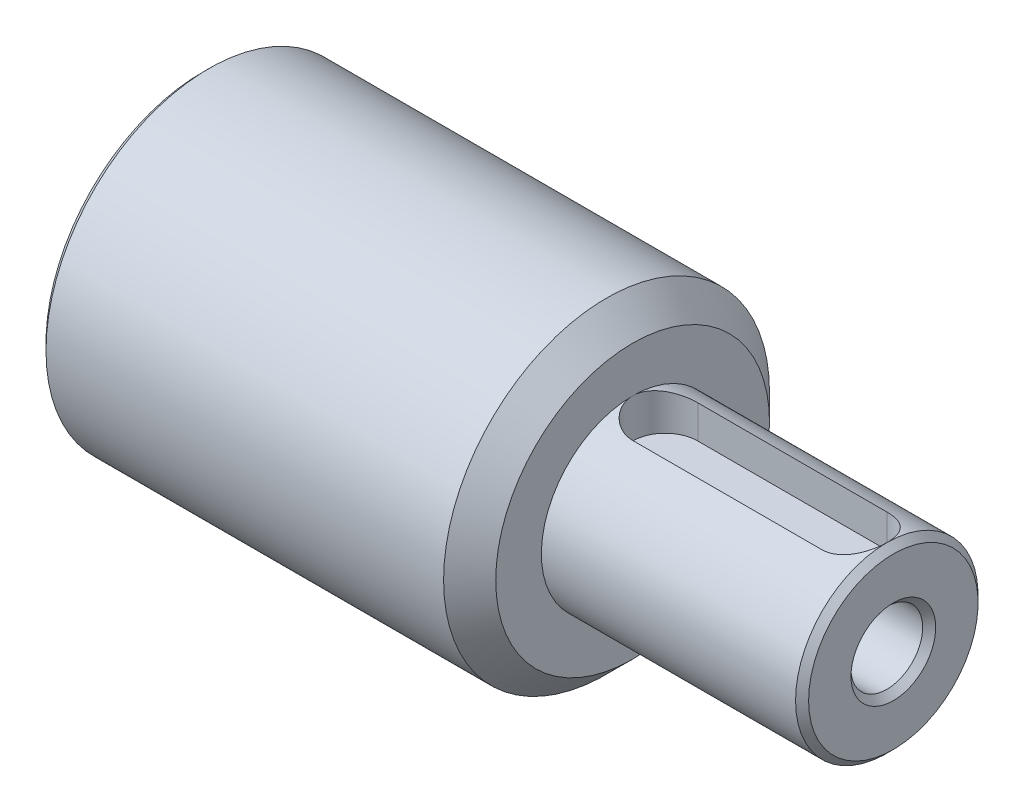
from build123d import *

# Parameters (mm, degrees)
SKETCH_2_W          = 5
SKETCH_2_H          = 9
CUT_EXTRUDE_1_DEPTH = 26
CHAMFER_1_SIZE      = 2
CHAMFER_2_SIZE      = 0.5
FILLET_1_R          = 1
CUT_EXTRUDE_2_DEPTH = 3


with BuildPart() as part:
    # 草图1 → 旋转1 (revolve)
    with BuildSketch(Plane.XY, mode=Mode.PRIVATE) as revolve_1_sk:
        Polygon((0, 7), (0, 12.5), (33, 12.5), (33, 7), (53, 7), (53, 2.75), (28, 2.75), (28, 7), align=None)
    revolve(revolve_1_sk.sketch.rotate(Axis((0, 0, 0), (1, 0, 0)), 90), axis=Axis((0, 0, 0), (1, 0, 0)))

    # 草图2 → 切除-拉伸1 (cut)
    with BuildSketch(Plane.ZY):
        with Locations((0, 4.5)):
            Rectangle(SKETCH_2_W, SKETCH_2_H)
    extrude(amount=-CUT_EXTRUDE_1_DEPTH, mode=Mode.SUBTRACT)

    # 倒角1
    chamfer_1_edges = [part.edges().sort_by_distance(p)[0] for p in [
        (33, 0, -12.5),
    ]]
    chamfer(chamfer_1_edges, length=CHAMFER_1_SIZE)

    # 倒角2
    chamfer_2_edges = [part.edges().sort_by_distance(p)[0] for p in [
        (0, -5.766281297, -3.968626967),
        (53, 0, -2.75),
        (53, 0, -7),
        (0, 0, -12.5),
    ]]
    chamfer(chamfer_2_edges, length=CHAMFER_2_SIZE)

    # 圆角1
    fillet_1_edges = [part.edges().sort_by_distance(p)[0] for p in [
        (28, 0, -7),
    ]]
    fillet(fillet_1_edges, radius=FILLET_1_R)

    # 草图3 → 切除-拉伸2 (cut)
    with BuildSketch(Plane(origin=(0, 7, 0), x_dir=(1, 0, 0), z_dir=(0, 1, 0))):
        with BuildLine():
            Line((35.5, 2.5), (50, 2.5))
            ThreePointArc((50, 2.5), (52.5, 0), (50, -2.5))
            Line((50, -2.5), (35.5, -2.5))
            ThreePointArc((35.5, -2.5), (33, 0), (35.5, 2.5))
        make_face()
    extrude(amount=-CUT_EXTRUDE_2_DEPTH, mode=Mode.SUBTRACT)


solid = part.part
